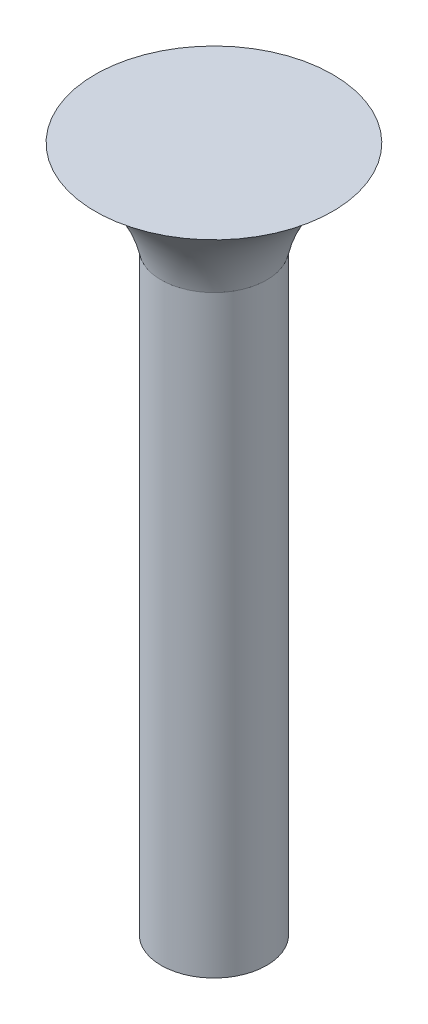
from build123d import *

# Parameters (mm, degrees)
SKETCH1_R           = 10.16
BOSS_EXTRUDE1_DEPTH = 132.08


with BuildPart() as part:
    # Sketch1 → Boss-Extrude1 (new body)
    with BuildSketch(Plane(origin=(0, 0, 0), x_dir=(1, 0, 0), z_dir=(0, 1, 0))):
        with Locations(Location((0, 0, 0), (0, 0, 270))):
            Circle(SKETCH1_R)
    extrude(amount=BOSS_EXTRUDE1_DEPTH)

    # Sketch2 → Revolve1 (revolve)
    with BuildSketch(Plane.XY, mode=Mode.PRIVATE) as revolve1_sk:
        with BuildLine():
            Line((10.16, 132.08), (10.16, 114.3))
            ThreePointArc((10.16, 114.3), (14.631236278, 124.531974087), (22.86, 132.08))
            Line((22.86, 132.08), (10.16, 132.08))
        make_face()
    revolve(revolve1_sk.sketch.rotate(Axis((0, 0, 0), (0, 1, 0)), 90), axis=Axis((0, 0, 0), (0, 1, 0)))


solid = part.part
